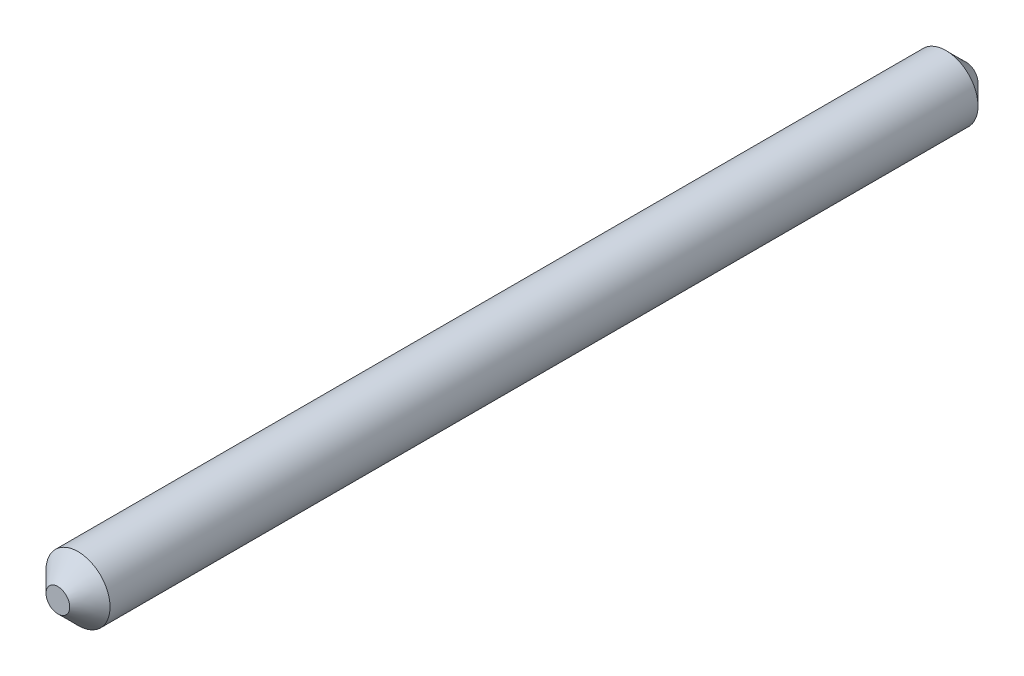
from build123d import *

# Parameters (mm, degrees)
SKETCH2_R           = 1.5875
BOSS_EXTRUDE1_DEPTH = 22.5
CHAMFER1_SIZE       = 1


with BuildPart() as part:
    # Sketch2 → Boss-Extrude1 (new, symmetric)
    with BuildSketch(Plane.XY):
        with Locations(Location((0, 0, 0), (0, 0, 180))):
            Circle(SKETCH2_R)
    extrude(amount=BOSS_EXTRUDE1_DEPTH, both=True)

    # Chamfer1
    chamfer1_edges = [part.edges().sort_by_distance(p)[0] for p in [
        (1.5875, 0, -22.5),
        (1.5875, 0, 22.5),
    ]]
    chamfer(chamfer1_edges, length=CHAMFER1_SIZE)


solid = part.part
